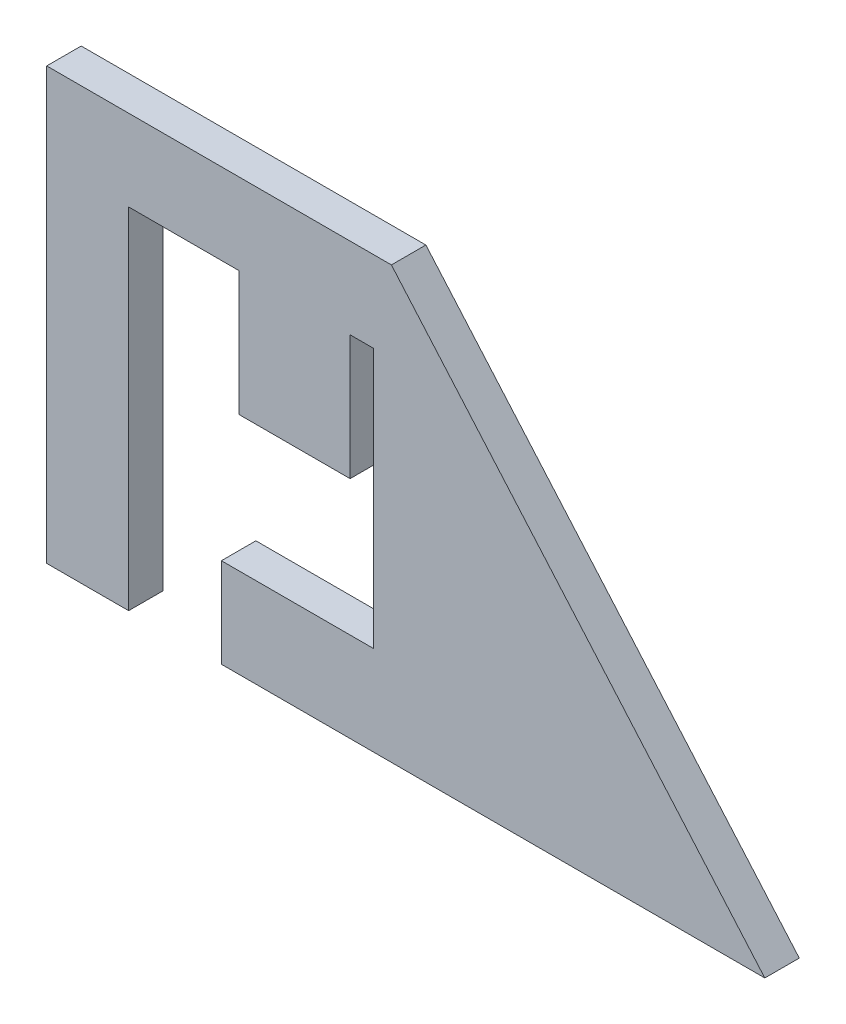
from build123d import *

# Parameters (mm, degrees)
BOSS_EXTRU_1_DEPTH      = 6
BOSS_EXTRU_1_DEPTH_BACK = 6
ENL_V_MAT_EXTRU_1_DEPTH = 292.794448199


with BuildPart() as part:
    # Esquisse1 → Boss.-Extru.1 (new, two sides: drawn at the far end of the back side and taken through both)
    with BuildSketch(Plane.XY.offset(-BOSS_EXTRU_1_DEPTH_BACK)):
        Polygon((0, 0), (250, 0), (120, 150), (0, 150), align=None)
    extrude(amount=BOSS_EXTRU_1_DEPTH + BOSS_EXTRU_1_DEPTH_BACK)

    # Esquisse2 → Enlèv. mat.-Extru.1 (cut, through all)
    with BuildSketch(Plane.XY.offset(6)):
        Polygon((28.515807323, 0), (28.515807323, 121.742691755), (67.012431024, 121.742691755), (67.012431024, 78.36465188), (105.62326997, 78.36465188), (105.62326997, 121.742691755), (113.72405631, 121.742691755), (113.72405631, 31.224508755), (60.816510283, 31.224508755), (60.816510283, 0), align=None)
    extrude(amount=-ENL_V_MAT_EXTRU_1_DEPTH, mode=Mode.SUBTRACT)


solid = part.part
